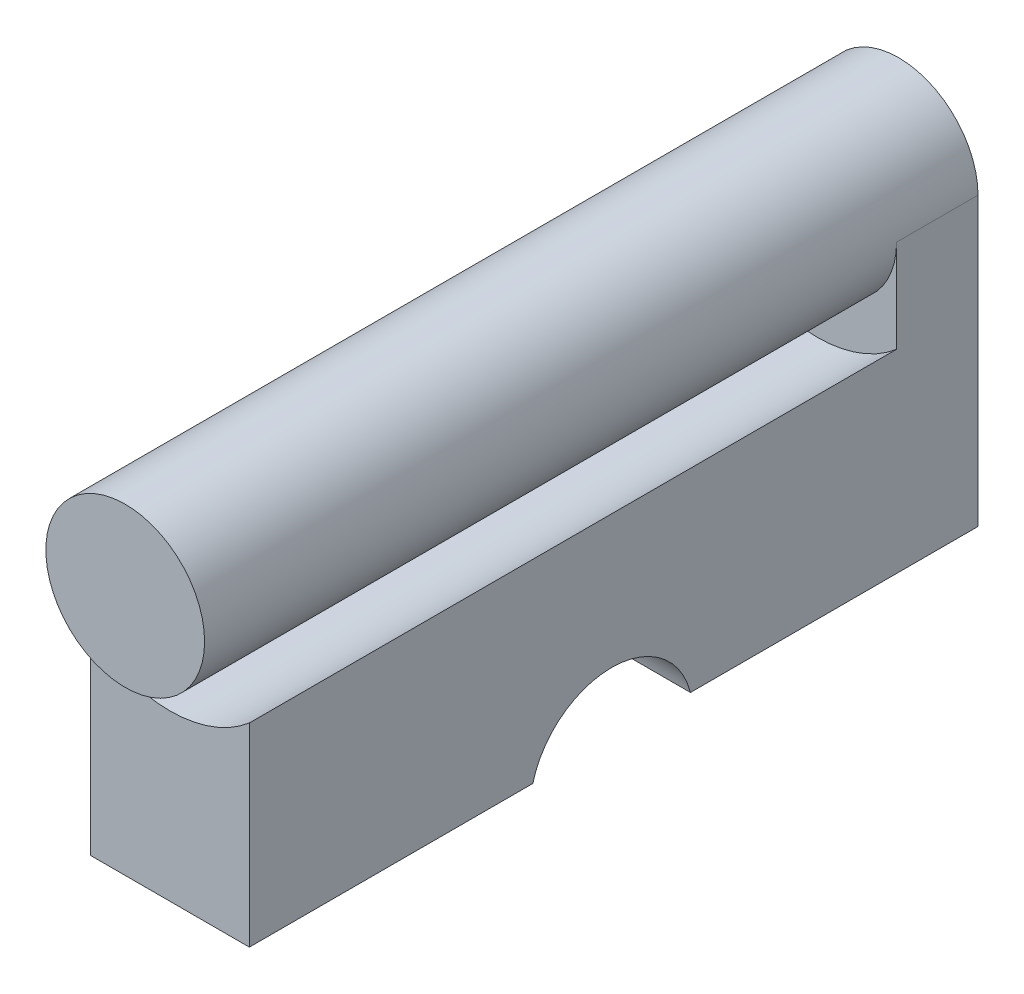
from build123d import *

# Parameters (mm, degrees)
SKETCH_1_R          = 1.95
EXTRUDE_1_DEPTH     = 19
SKETCH_4_W          = 2
SKETCH_4_H          = 9
EXTRUDE_2_DEPTH     = 1.95
CUT_EXTRUDE_1_DEPTH = 21.359396
EXTRUDE_4_DEPTH     = 15.9
SKETCH_9_R          = 2
CUT_EXTRUDE_2_DEPTH = 17


with BuildPart() as part:
    # 스케치1 → 보스-돌출1 (new body)
    with BuildSketch(Plane.XY):
        Circle(SKETCH_1_R)
    extrude(amount=EXTRUDE_1_DEPTH)

    # 스케치4 → 보스-돌출2 (add, symmetric)
    with BuildSketch(Plane(origin=(0, 0, 0), x_dir=(0, 0, -1), z_dir=(1, 0, 0))):
        with Locations((-1, -2.55)):
            Rectangle(SKETCH_4_W, SKETCH_4_H)
    extrude(amount=EXTRUDE_2_DEPTH, both=True)

    # 스케치5 → 컷-돌출1 (cut, through all)
    with BuildSketch(Plane.XY.offset(19)):
        with BuildLine():
            Line((-1.95, 1.95), (-1.95, 0))
            ThreePointArc((-1.95, 0), (-1.378858, 1.378858), (0, 1.95))
            Line((0, 1.95), (-1.95, 1.95))
        make_face()
        with BuildLine():
            ThreePointArc((0, 1.95), (1.378858, 1.378858), (1.95, 0))
            Line((1.95, 0), (1.95, 1.95))
            Line((1.95, 1.95), (0, 1.95))
        make_face()
    extrude(amount=-CUT_EXTRUDE_1_DEPTH, mode=Mode.SUBTRACT)

    # 스케치8 → 보스-돌출4 (add)
    with BuildSketch(Plane.XY.offset(2)):
        with BuildLine():
            ThreePointArc((1.95, -2.279803), (0, -3), (-1.95, -2.279803))
            Line((-1.95, -2.279803), (-1.95, -7.05))
            Line((-1.95, -7.05), (1.95, -7.05))
            Line((1.95, -7.05), (1.95, -2.279803))
        make_face()
    extrude(amount=EXTRUDE_4_DEPTH)

    # 스케치9 → 컷-돌출2 (cut)
    with BuildSketch(Plane.ZY.offset(1.95)):
        with Locations((9, -7.55)):
            Circle(SKETCH_9_R)
    extrude(amount=-CUT_EXTRUDE_2_DEPTH, mode=Mode.SUBTRACT)


solid = part.part
